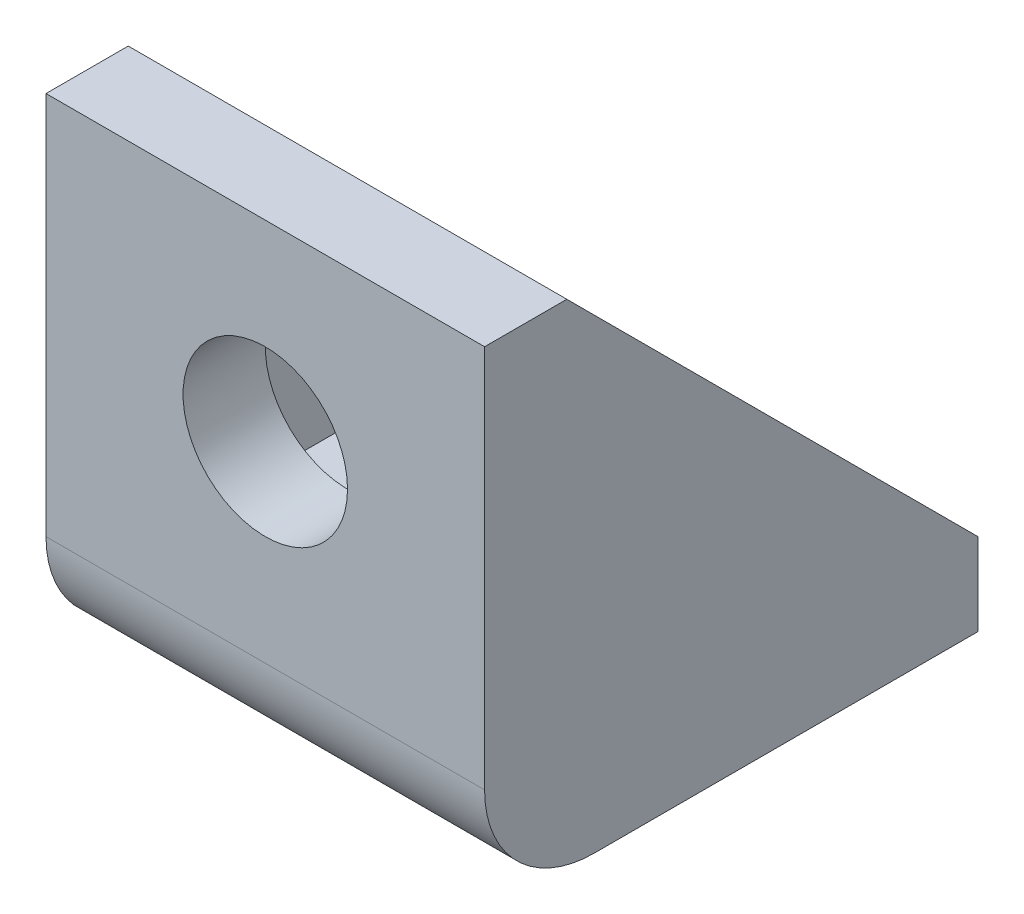
from build123d import *

# Parameters (mm, degrees)
BOSS_EXTRUDE1_DEPTH = 4
BOSS_EXTRUDE2_DEPTH = 0.5
SKETCH3_R           = 1.5
CUT_EXTRUDE1_DEPTH  = 14.341664064
SKETCH4_R           = 1.5
CUT_EXTRUDE2_DEPTH  = 14.341664064
FILLET1_R           = 2


with BuildPart() as part:
    # Sketch1 → Boss-Extrude1 (new, symmetric)
    with BuildSketch(Plane(origin=(0, 0, 0), x_dir=(0, 0, -1), z_dir=(1, 0, 0))):
        Polygon((0, 1.664846908), (0, 0), (1.75206606, 0), (9, 0), (9, 1.5), (1.5, 1.5), (1.5, 9), (0, 9), align=None)
    extrude(amount=BOSS_EXTRUDE1_DEPTH, both=True)

    # Sketch2 → Boss-Extrude2 (add)
    with BuildSketch(Plane(origin=(4, 0, 0), x_dir=(0, 0, -1), z_dir=(1, 0, 0))):
        Polygon((1.5, 9), (9, 1.5), (1.5, 1.5), align=None)
    boss_extrude2 = extrude(amount=-BOSS_EXTRUDE2_DEPTH)

    # Mirror1: Boss-Extrude2 across plane
    add(boss_extrude2.mirror(Plane(origin=(0, 0, 0), x_dir=(0, 0, 1), z_dir=(1, 0, 0))))

    # Sketch3 → Cut-Extrude1 (cut, through all)
    with BuildSketch(Plane.XY):
        with Locations((0, 5.5)):
            Circle(SKETCH3_R)
    extrude(amount=-CUT_EXTRUDE1_DEPTH, mode=Mode.SUBTRACT)

    # Sketch4 → Cut-Extrude2 (cut, through all)
    with BuildSketch(Plane.XZ):
        with Locations(Location((0, -5.5, 0), (0, 0, 270))):
            Circle(SKETCH4_R)
    extrude(amount=-CUT_EXTRUDE2_DEPTH, mode=Mode.SUBTRACT)

    # Fillet1
    fillet1_edges = [part.edges().sort_by_distance(p)[0] for p in [
        (0, 0, 0),
    ]]
    fillet(fillet1_edges, radius=FILLET1_R)


solid = part.part
